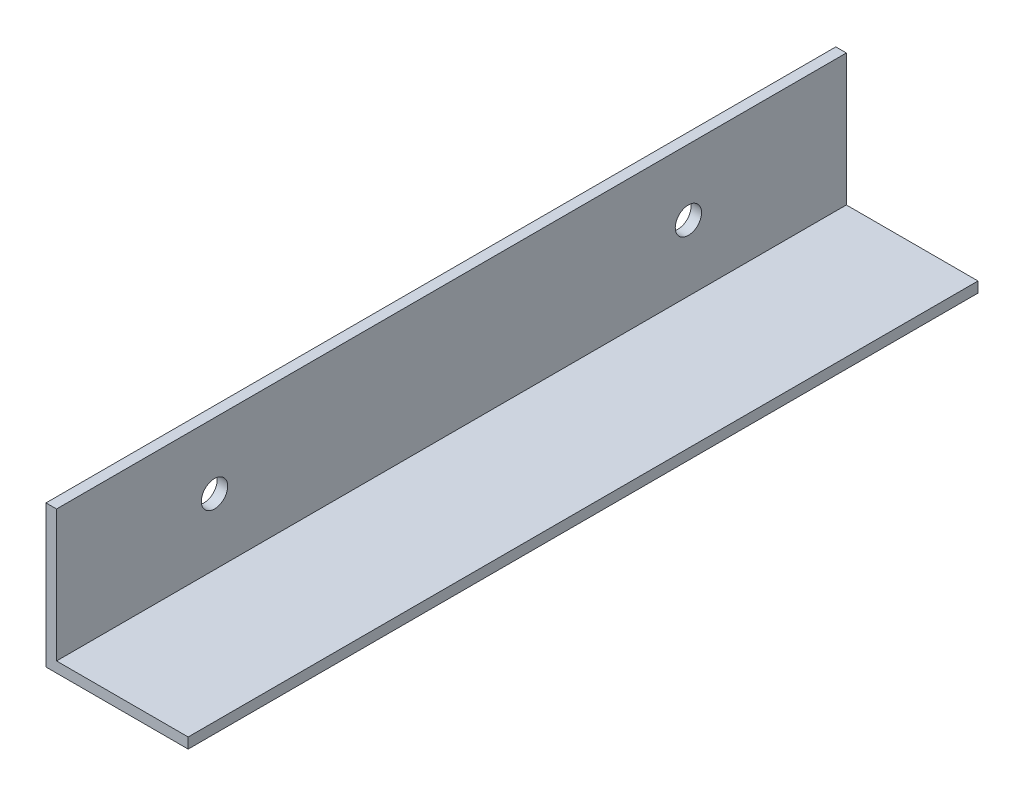
from build123d import *

# Parameters (mm, degrees)
BOSS_EXTRUDE1_DEPTH     = 150
CUT_EXTRUDE1_DEPTH      = 155.110350074
CUT_EXTRUDE1_DEPTH_BACK = 155.110350074
SKETCH2_R               = 2.5


with BuildPart() as part:
    # Sketch1 → Boss-Extrude1 (new body)
    with BuildSketch(Plane.XY):
        Polygon((0, 0), (25, 0), (25, -2), (-2, -2), (-2, 25), (0, 25), align=None)
    extrude(amount=BOSS_EXTRUDE1_DEPTH)

    # Sketch2 → Cut-Extrude1 (cut, two sides: drawn at the far end of the back side and taken through both)
    with BuildSketch(Plane(origin=(0, 0, 0), x_dir=(0, 0, -1), z_dir=(1, 0, 0)).offset(-CUT_EXTRUDE1_DEPTH_BACK)):
        with Locations((-120, 12.5)):
            Circle(SKETCH2_R)
        with Locations((-30, 12.5)):
            Circle(SKETCH2_R)
    extrude(amount=CUT_EXTRUDE1_DEPTH + CUT_EXTRUDE1_DEPTH_BACK, mode=Mode.SUBTRACT)


solid = part.part
